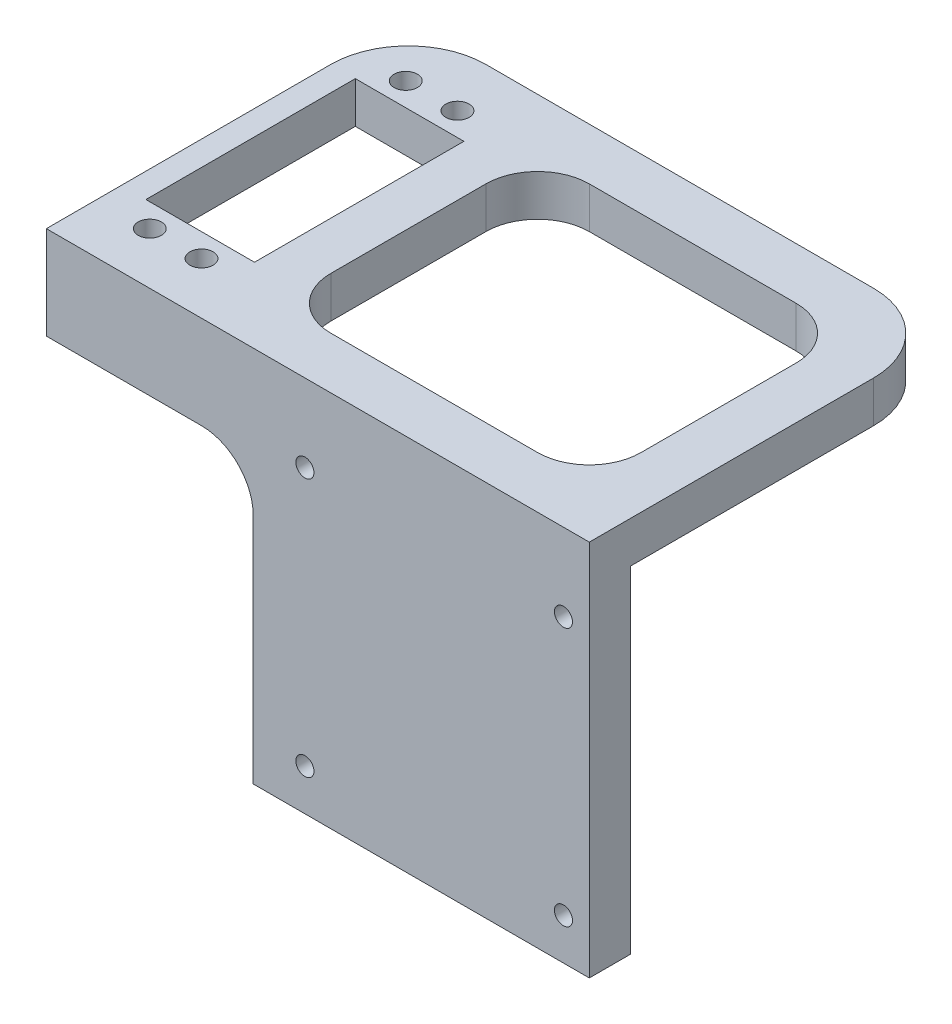
from build123d import *

# Parameters (mm, degrees)
SKETCH2_W           = 105
SKETCH2_H           = 70
BOSS_EXTRUDE1_DEPTH = 8
SKETCH4_W           = 105
SKETCH4_H           = 8
BOSS_EXTRUDE2_DEPTH = 65
SKETCH6_R           = 1.75
CUT_EXTRUDE1_DEPTH  = 10
SKETCH7_R           = 3.5
CUT_EXTRUDE2_DEPTH  = 3
SKETCH9_W           = 21
SKETCH9_H           = 40.5
CUT_EXTRUDE3_DEPTH  = 10
SKETCH10_R          = 2.25
CUT_EXTRUDE4_DEPTH  = 10
FILLET1_R           = 15
FILLET2_R           = 15
SKETCH12_W          = 60
SKETCH12_H          = 50
CUT_EXTRUDE5_DEPTH  = 10
FILLET3_R           = 10
FILLET4_R           = 10
FILLET5_R           = 10
FILLET6_R           = 10
SKETCH13_W          = 40
SKETCH13_H          = 55
CUT_EXTRUDE6_DEPTH  = 10
FILLET7_R           = 10


with BuildPart() as part:
    # Sketch2 → Boss-Extrude1 (new body)
    with BuildSketch(Plane(origin=(0, 0, 0), x_dir=(1, 0, 0), z_dir=(0, 1, 0))):
        with Locations((37.5, 2.5)):
            Rectangle(SKETCH2_W, SKETCH2_H)
    extrude(amount=BOSS_EXTRUDE1_DEPTH)

    # Sketch4 → Boss-Extrude2 (add)
    with BuildSketch(Plane(origin=(0, 0, 0), x_dir=(-1, 0, 0), z_dir=(0, -1, 0))):
        with Locations((-37.5, -28.5)):
            Rectangle(SKETCH4_W, SKETCH4_H)
    extrude(amount=BOSS_EXTRUDE2_DEPTH)

    # Sketch6 → Cut-Extrude1 (cut)
    with BuildSketch(Plane(origin=(0, 0, 24.5), x_dir=(-1, 0, 0), z_dir=(0, 0, -1))):
        with Locations((-85, -7)):
            Circle(SKETCH6_R)
        with Locations((-35, -7)):
            Circle(SKETCH6_R)
        with Locations((-85, -57)):
            Circle(SKETCH6_R)
        with Locations((-35, -57)):
            Circle(SKETCH6_R)
    extrude(amount=-CUT_EXTRUDE1_DEPTH, mode=Mode.SUBTRACT)

    # Sketch7 → Cut-Extrude2 (cut)
    with BuildSketch(Plane(origin=(0, 0, 24.5), x_dir=(-1, 0, 0), z_dir=(0, 0, -1))):
        with Locations((-85, -7)):
            Circle(SKETCH7_R)
        with Locations((-35, -7)):
            Circle(SKETCH7_R)
        with Locations((-35, -57)):
            Circle(SKETCH7_R)
        with Locations((-85, -57)):
            Circle(SKETCH7_R)
    extrude(amount=-CUT_EXTRUDE2_DEPTH, mode=Mode.SUBTRACT)

    # Sketch9 → Cut-Extrude3 (cut)
    with BuildSketch(Plane(origin=(0, 8, 0), x_dir=(1, 0, 0), z_dir=(0, 1, 0))):
        with Locations((0.25, 2.25)):
            Rectangle(SKETCH9_W, SKETCH9_H)
    extrude(amount=-CUT_EXTRUDE3_DEPTH, mode=Mode.SUBTRACT)

    # Sketch10 → Cut-Extrude4 (cut)
    with BuildSketch(Plane(origin=(0, 8, 0), x_dir=(1, 0, 0), z_dir=(0, 1, 0))):
        with Locations(Location((-5, 27, 0), (0, 0, 270))):
            Circle(SKETCH10_R)
        with Locations(Location((5, 27, 0), (0, 0, 270))):
            Circle(SKETCH10_R)
        with Locations(Location((-5, -22.5, 0), (0, 0, 270))):
            Circle(SKETCH10_R)
        with Locations(Location((5, -22.5, 0), (0, 0, 270))):
            Circle(SKETCH10_R)
    extrude(amount=-CUT_EXTRUDE4_DEPTH, mode=Mode.SUBTRACT)

    # Fillet1
    fillet1_edges = [part.edges().sort_by_distance(p)[0] for p in [
        (90, 4, -37.5),
    ]]
    fillet(fillet1_edges, radius=FILLET1_R)

    # Fillet2
    fillet2_edges = [part.edges().sort_by_distance(p)[0] for p in [
        (-15, 4, -37.5),
    ]]
    fillet(fillet2_edges, radius=FILLET2_R)

    # Sketch12 → Cut-Extrude5 (cut)
    with BuildSketch(Plane(origin=(0, 8, 0), x_dir=(1, 0, 0), z_dir=(0, 1, 0))):
        with Locations((50, 2.5)):
            Rectangle(SKETCH12_W, SKETCH12_H)
    extrude(amount=-CUT_EXTRUDE5_DEPTH, mode=Mode.SUBTRACT)

    # Fillet3
    fillet3_edges = [part.edges().sort_by_distance(p)[0] for p in [
        (20, 4, 22.5),
    ]]
    fillet(fillet3_edges, radius=FILLET3_R)

    # Fillet4
    fillet4_edges = [part.edges().sort_by_distance(p)[0] for p in [
        (80, 4, 22.5),
    ]]
    fillet(fillet4_edges, radius=FILLET4_R)

    # Fillet5
    fillet5_edges = [part.edges().sort_by_distance(p)[0] for p in [
        (80, 4, -27.5),
    ]]
    fillet(fillet5_edges, radius=FILLET5_R)

    # Fillet6
    fillet6_edges = [part.edges().sort_by_distance(p)[0] for p in [
        (20, 4, -27.5),
    ]]
    fillet(fillet6_edges, radius=FILLET6_R)

    # Sketch13 → Cut-Extrude6 (cut)
    with BuildSketch(Plane(origin=(0, 0, 24.5), x_dir=(-1, 0, 0), z_dir=(0, 0, -1))):
        with Locations((-5, -37.5)):
            Rectangle(SKETCH13_W, SKETCH13_H)
    extrude(amount=-CUT_EXTRUDE6_DEPTH, mode=Mode.SUBTRACT)

    # Fillet7
    fillet7_edges = [part.edges().sort_by_distance(p)[0] for p in [
        (25, -10, 28.5),
    ]]
    fillet(fillet7_edges, radius=FILLET7_R)


solid = part.part
